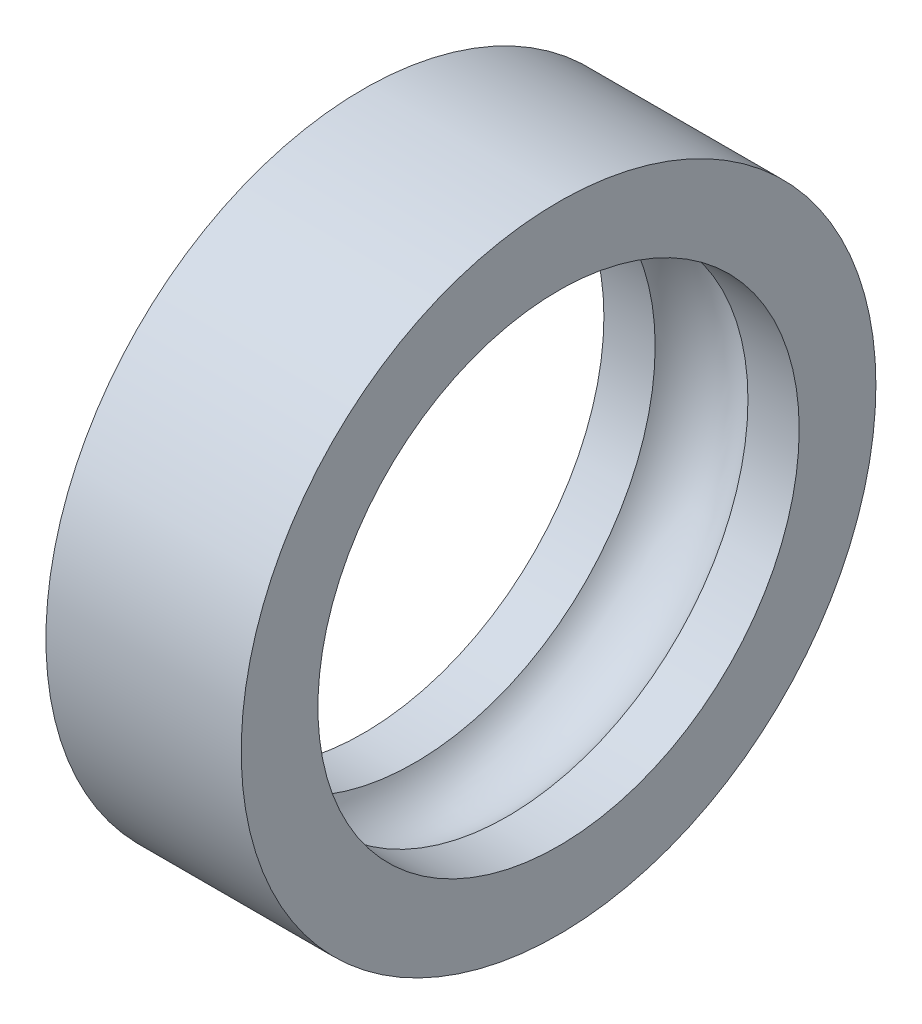
from build123d import *

# Parameters (mm, degrees)
SCALE2_SCALE = 6
SCALE3_SCALE = 3.323882225


with BuildPart() as part:
    # Sketch1 → Revolve1 (revolve)
    with BuildSketch(Plane.XY, mode=Mode.PRIVATE) as revolve1_sk:
        with BuildLine():
            Line((0, 4.25), (4, 4.25))
            Line((4, 4.25), (4, 1.108))
            Line((4, 1.108), (1.900614637, 1.108))
            ThreePointArc((1.900614637, 1.108), (0, 2.2), (-1.900614637, 1.108))
            Line((-1.900614637, 1.108), (-4, 1.108))
            Line((-4, 1.108), (-4, 4.25))
            Line((-4, 4.25), (0, 4.25))
        make_face()
    revolve(revolve1_sk.sketch.rotate(Axis((4, -8.75, 0), (-1, 0, 0)), 90), axis=Axis((4, -8.75, 0), (-1, 0, 0)))


with BuildPart() as part_1:
    # Scale2: scaled about (0, -8.75, 0)
    add(part.part.scale(SCALE2_SCALE).moved(Location((0, 43.75, 0))))


with BuildPart() as part_2:
    # Scale3: scaled about (0, -8.75, 0)
    add(part_1.part.scale(SCALE3_SCALE).moved(Location((0, 20.333969466, 0))))


solid = part_2.part
